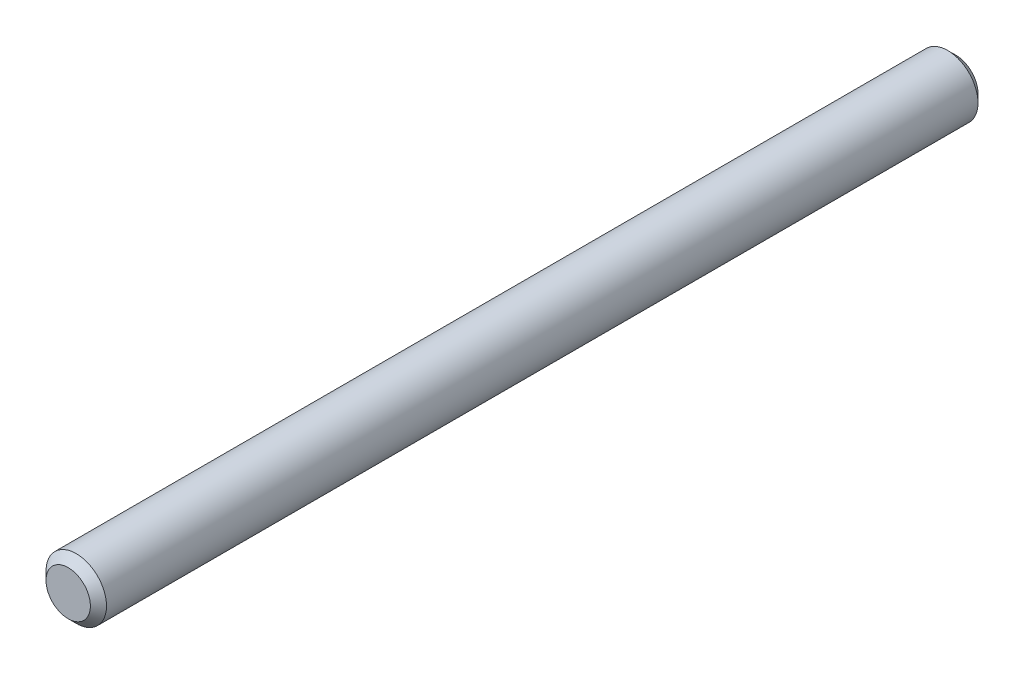
from build123d import *

# Parameters (mm, degrees)
SKETCH1_R           = 7.5
BOSS_EXTRUDE1_DEPTH = 110
CHAMFER1_SIZE       = 2
CHAMFER2_SIZE       = 2


with BuildPart() as part:
    # Sketch1 → Boss-Extrude1 (new, symmetric)
    with BuildSketch(Plane.XY):
        Circle(SKETCH1_R)
    extrude(amount=BOSS_EXTRUDE1_DEPTH, both=True)

    # Chamfer1
    chamfer1_edges = [part.edges().sort_by_distance(p)[0] for p in [
        (-7.5, 0, -110),
    ]]
    chamfer(chamfer1_edges, length=CHAMFER1_SIZE)

    # Chamfer2
    chamfer2_edges = [part.edges().sort_by_distance(p)[0] for p in [
        (-7.5, 0, 110),
    ]]
    chamfer(chamfer2_edges, length=CHAMFER2_SIZE)


solid = part.part
